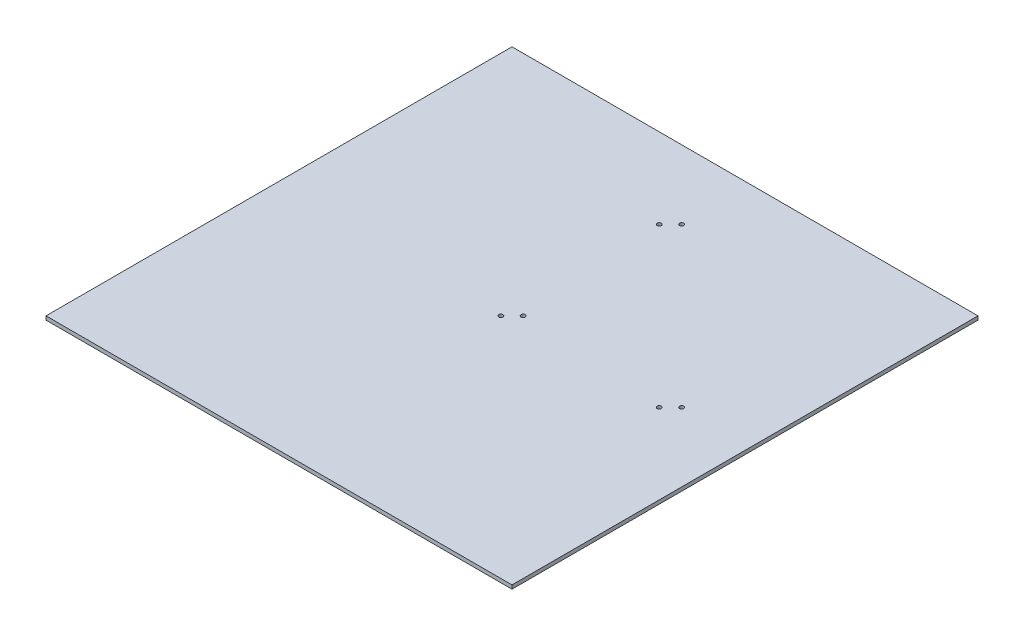
from build123d import *

# Parameters (mm, degrees)
ESBO_O1_W                = 500
ESBO_O1_H                = 500
RESSALTO_EXTRUS_O1_DEPTH = 4
ESBO_O3_R                = 2.25
CORTE_EXTRUS_O1_DEPTH    = 4


with BuildPart() as part:
    # Esboço1 → Ressalto-extrusão1 (new body)
    with BuildSketch(Plane(origin=(0, 0, 0), x_dir=(1, 0, 0), z_dir=(0, 1, 0))):
        with Locations((250, 250)):
            Rectangle(ESBO_O1_W, ESBO_O1_H)
    extrude(amount=RESSALTO_EXTRUS_O1_DEPTH)

    # Esboço3 → Corte-extrusão1 (cut)
    with BuildSketch(Plane(origin=(0, 4, 0), x_dir=(1, 0, 0), z_dir=(0, 1, 0))):
        with Locations(Location((256.01040764, 256.01040764, 0), (0, 0, 270))):
            Circle(ESBO_O3_R)
        with Locations(Location((243.98959236, 243.98959236, 0), (0, 0, 270))):
            Circle(ESBO_O3_R)
        with Locations(Location((426.01040764, 256.01040764, 0), (0, 0, 270))):
            Circle(ESBO_O3_R)
        with Locations(Location((413.98959236, 243.98959236, 0), (0, 0, 270))):
            Circle(ESBO_O3_R)
        with Locations(Location((243.98959236, 413.98959236, 0), (0, 0, 270))):
            Circle(ESBO_O3_R)
        with Locations(Location((256.01040764, 426.01040764, 0), (0, 0, 270))):
            Circle(ESBO_O3_R)
    extrude(amount=-CORTE_EXTRUS_O1_DEPTH, mode=Mode.SUBTRACT)


solid = part.part
